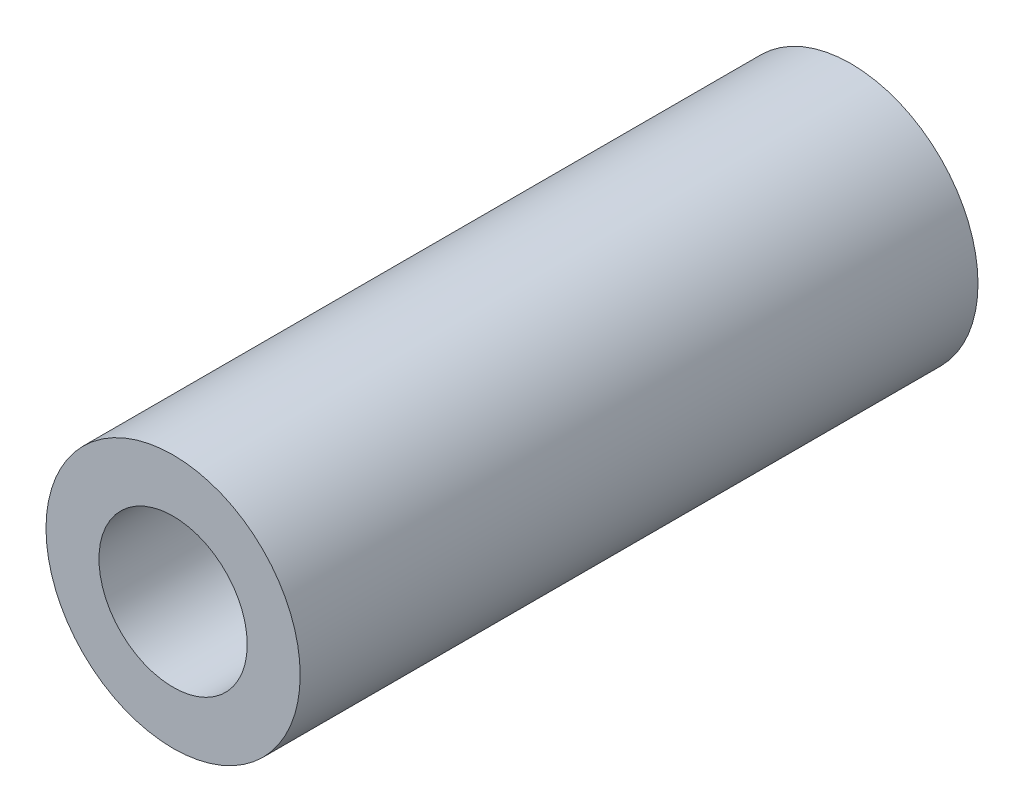
from build123d import *

# Parameters (mm, degrees)
ESQUISSE1_R             = 3
BOSS_EXTRU_1_DEPTH      = 16
ESQUISSE2_R             = 1.75
ENL_V_MAT_EXTRU_1_DEPTH = 17.552945357


with BuildPart() as part:
    # Esquisse1 → Boss.-Extru.1 (new body)
    with BuildSketch(Plane.XY):
        Circle(ESQUISSE1_R)
    extrude(amount=BOSS_EXTRU_1_DEPTH)

    # Esquisse2 → Enlèv. mat.-Extru.1 (cut, through all)
    with BuildSketch(Plane.XY.offset(16)):
        Circle(ESQUISSE2_R)
    extrude(amount=-ENL_V_MAT_EXTRU_1_DEPTH, mode=Mode.SUBTRACT)


solid = part.part
